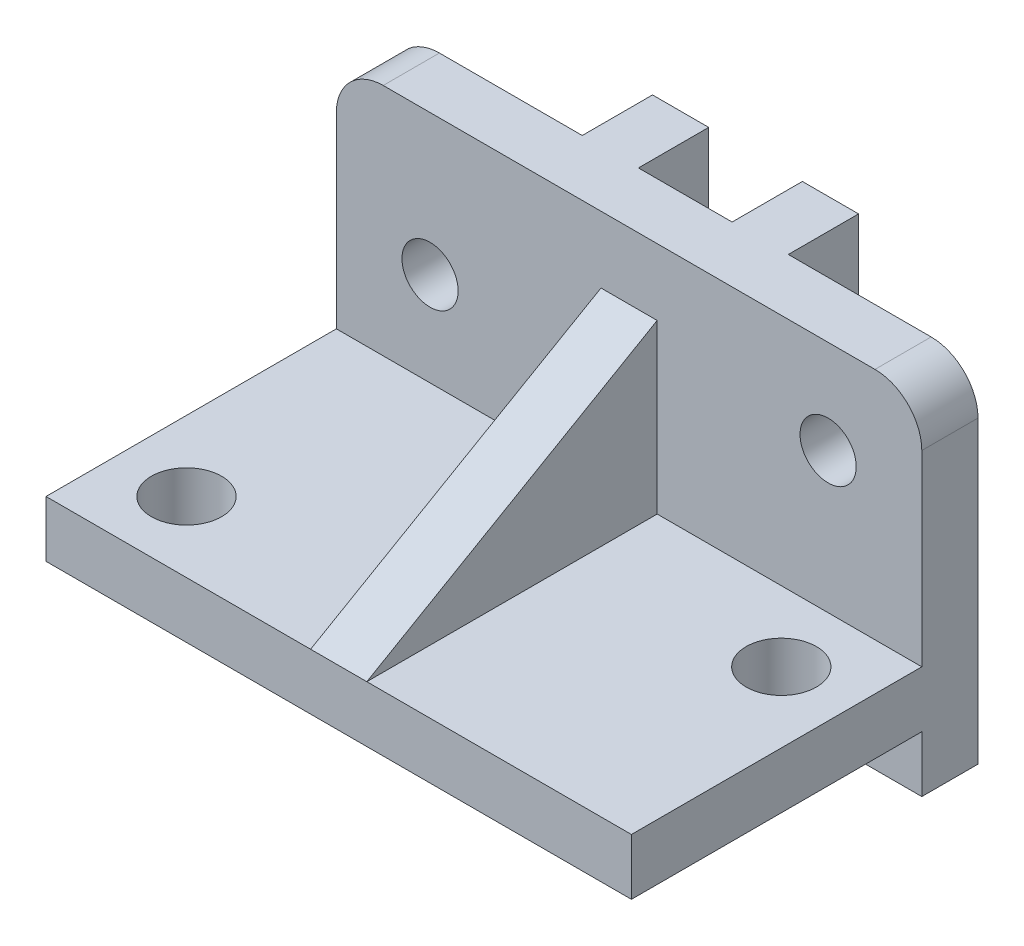
from build123d import *

# Parameters (mm, degrees)
SKETCH1_W           = 125
SKETCH1_H           = 62
SKETCH1_R           = 7.5
BOSS_EXTRUDE2_DEPTH = 12
SKETCH1_3_W         = 125
SKETCH1_3_H         = 12
BOSS_EXTRUDE3_DEPTH = 62
SKETCH1_4_W         = 125
SKETCH1_4_H         = 12
BOSS_EXTRUDE4_DEPTH = 12
CUT_EXTRUDE1_REACH  = 154.686
SKETCH3_R           = 6
SKETCH4_W           = 12
SKETCH4_H           = 74
BOSS_EXTRUDE5_DEPTH = 15
SKETCH5_W           = 12
SKETCH5_H           = 62
BOSS_EXTRUDE6_DEPTH = 50
CUT_EXTRUDE2_REACH  = 130.286


with BuildPart() as part:
    # Sketch1 → Boss-Extrude2 (new body)
    with BuildSketch(Plane(origin=(0, 0, 0), x_dir=(1, 0, 0), z_dir=(0, 1, 0))):
        with Locations((62.5, 31)):
            Rectangle(SKETCH1_W, SKETCH1_H)
        with Locations((15, 15)):
            Circle(SKETCH1_R, mode=Mode.SUBTRACT)
        with Locations((110, 47)):
            Circle(SKETCH1_R, mode=Mode.SUBTRACT)
    extrude(amount=BOSS_EXTRUDE2_DEPTH)

    # Sketch1<3> → Boss-Extrude3 (add)
    with BuildSketch(Plane(origin=(0, 0, 0), x_dir=(1, 0, 0), z_dir=(0, 1, 0))):
        with Locations((62.5, 68)):
            Rectangle(SKETCH1_3_W, SKETCH1_3_H)
    extrude(amount=BOSS_EXTRUDE3_DEPTH)

    # Sketch1<4> → Boss-Extrude4 (add)
    with BuildSketch(Plane(origin=(0, 0, 0), x_dir=(1, 0, 0), z_dir=(0, 1, 0))):
        with Locations((62.5, 68)):
            Rectangle(SKETCH1_4_W, SKETCH1_4_H)
    extrude(amount=-BOSS_EXTRUDE4_DEPTH)

    # Sketch3 → Cut-Extrude1 (cut, up to next)
    with BuildSketch(Plane.XY.offset(-62), mode=Mode.PRIVATE) as cut_extrude1_sk1:
        with Locations((105, 42)):
            Circle(SKETCH3_R)
    cut_extrude1_tool1 = extrude(cut_extrude1_sk1.sketch, amount=-CUT_EXTRUDE1_REACH, mode=Mode.PRIVATE) & part.part
    # Sketch3 → Cut-Extrude1 (cut, up to next)
    with BuildSketch(Plane.XY.offset(-62), mode=Mode.PRIVATE) as cut_extrude1_sk2:
        with Locations((20, 32)):
            Circle(SKETCH3_R)
    cut_extrude1_tool2 = extrude(cut_extrude1_sk2.sketch, amount=-CUT_EXTRUDE1_REACH, mode=Mode.PRIVATE) & part.part
    # Sketch3 → Cut-Extrude1 (cut, up to next)
    with BuildSketch(Plane.XY.offset(-62), mode=Mode.PRIVATE) as cut_extrude1_sk3:
        with BuildLine():
            Line((115, 62), (125, 62))
            Line((125, 62), (125, 52))
            ThreePointArc((125, 52), (122.071067812, 59.071067812), (115, 62))
        make_face()
    cut_extrude1_tool3 = extrude(cut_extrude1_sk3.sketch, amount=-CUT_EXTRUDE1_REACH, mode=Mode.PRIVATE) & part.part
    # Sketch3 → Cut-Extrude1 (cut, up to next)
    with BuildSketch(Plane.XY.offset(-62), mode=Mode.PRIVATE) as cut_extrude1_sk4:
        with BuildLine():
            Line((0, 62), (0, 52))
            ThreePointArc((0, 52), (2.928932188, 59.071067812), (10, 62))
            Line((10, 62), (0, 62))
        make_face()
    cut_extrude1_tool4 = extrude(cut_extrude1_sk4.sketch, amount=-CUT_EXTRUDE1_REACH, mode=Mode.PRIVATE) & part.part
    add(cut_extrude1_tool1.solids().sort_by_distance((105, 42, -62))[0], mode=Mode.SUBTRACT)
    add(cut_extrude1_tool2.solids().sort_by_distance((20, 32, -62))[0], mode=Mode.SUBTRACT)
    add(cut_extrude1_tool3.solids().sort_by_distance((122.766321, 59.766321, -62))[0], mode=Mode.SUBTRACT)
    add(cut_extrude1_tool4.solids().sort_by_distance((2.233679, 59.766321, -62))[0], mode=Mode.SUBTRACT)

    # Sketch4 → Boss-Extrude5 (add)
    with BuildSketch(Plane(origin=(0, 0, -74), x_dir=(-1, 0, 0), z_dir=(0, 0, -1))):
        with Locations((-78.5, 25)):
            Rectangle(SKETCH4_W, SKETCH4_H)
        with Locations((-46.5, 25)):
            Rectangle(SKETCH4_W, SKETCH4_H)
    extrude(amount=BOSS_EXTRUDE5_DEPTH)

    # Sketch5 → Boss-Extrude6 (add)
    with BuildSketch(Plane(origin=(0, 12, 0), x_dir=(1, 0, 0), z_dir=(0, 1, 0))):
        with Locations((62.5, 31)):
            Rectangle(SKETCH5_W, SKETCH5_H)
    extrude(amount=BOSS_EXTRUDE6_DEPTH)

    # Sketch6 → Cut-Extrude2 (cut, up to next)
    with BuildSketch(Plane(origin=(68.5, 0, 0), x_dir=(0, 0, -1), z_dir=(1, 0, 0)), mode=Mode.PRIVATE) as cut_extrude2_sk1:
        Polygon((0, 12), (62, 47.79571669), (62, 62), (0, 62), align=None)
    cut_extrude2_tool1 = extrude(cut_extrude2_sk1.sketch, amount=-CUT_EXTRUDE2_REACH, mode=Mode.PRIVATE) & part.part
    add(cut_extrude2_tool1.solids().sort_by_distance((68.5, 44.285835, -25.238872))[0], mode=Mode.SUBTRACT)


solid = part.part
